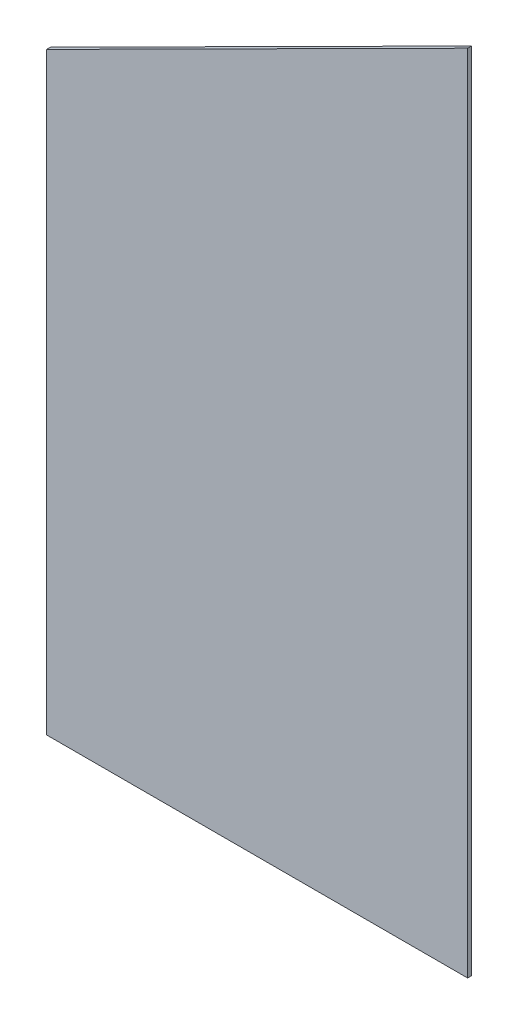
from build123d import *

# Parameters (mm, degrees)
BOSS_EXTRU_1_DEPTH = 2


with BuildPart() as part:
    # Esquisse1 → Boss.-Extru.1 (new body)
    with BuildSketch(Plane.XY):
        Polygon((-109.606398469, 99.661175131), (-109.606398469, -210), (110, -210), (110, 210), align=None)
    extrude(amount=BOSS_EXTRU_1_DEPTH)


solid = part.part
